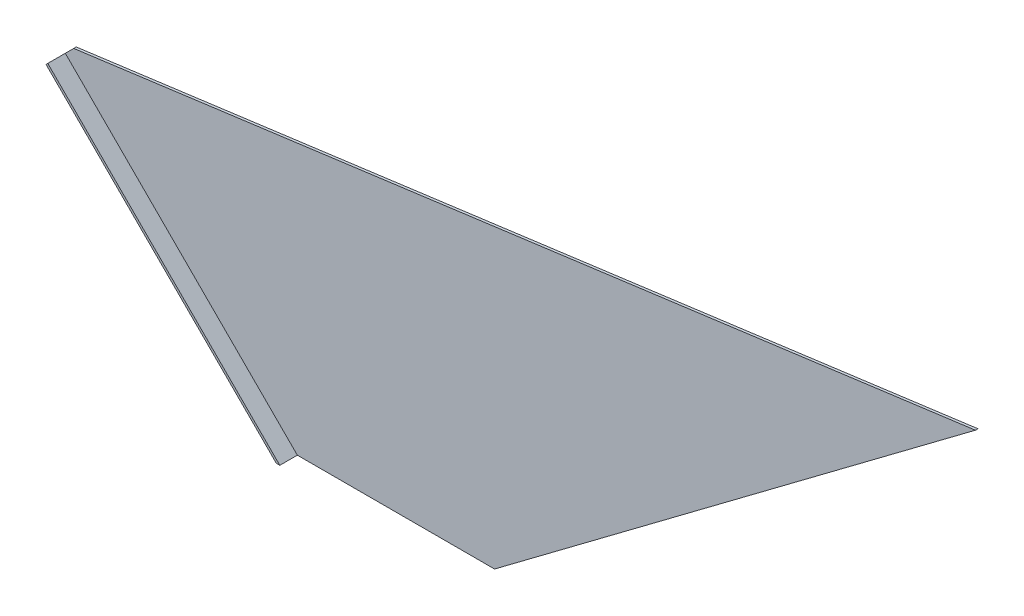
from build123d import *

# Parameters (mm, degrees)
BOSS_EXTRUDE1_DEPTH = 1.5875
BOSS_EXTRUDE2_DEPTH = 215.526147
CUT_EXTRUDE1_DEPTH  = 12.7


with BuildPart() as part:
    # Sketch2 → Boss-Extrude1 (new body)
    with BuildSketch(Plane.XY):
        Polygon((0, 0), (114.3, 0), (419.1, 228.6), (-152.4, 152.4), align=None)
    extrude(amount=BOSS_EXTRUDE1_DEPTH)

    # Sketch6 → Boss-Extrude2 (add)
    with BuildSketch(Plane(origin=(-152.4, 152.4, 0), x_dir=(0, 0, -1), z_dir=(-0.7071067811865476, 0.7071067811865476, 0))):
        with BuildLine():
            Line((0, 7.5438), (0, 7.8613))
            ThreePointArc((0, 7.8613), (-0.371974388, 8.759325612), (-1.27, 9.1313))
            Line((-1.27, 9.1313), (-12.7, 9.1313))
            Line((-12.7, 9.1313), (-12.7, 7.5438))
            Line((-12.7, 7.5438), (-1.5875, 7.5438))
            Line((-1.5875, 7.5438), (-1.5875, 0))
            Line((-1.5875, 0), (0, 0))
            Line((0, 0), (0, 7.5438))
        make_face()
    extrude(amount=-BOSS_EXTRUDE2_DEPTH)

    # Sketch7 → Cut-Extrude1 (cut)
    with BuildSketch(Plane(origin=(0, 0, 0), x_dir=(-1, 0, 0), z_dir=(0, 0, -1))):
        Polygon((0, 0), (12.913608302, 0), (6.456804151, -6.456804151), align=None)
    extrude(amount=-CUT_EXTRUDE1_DEPTH, mode=Mode.SUBTRACT)


solid = part.part
